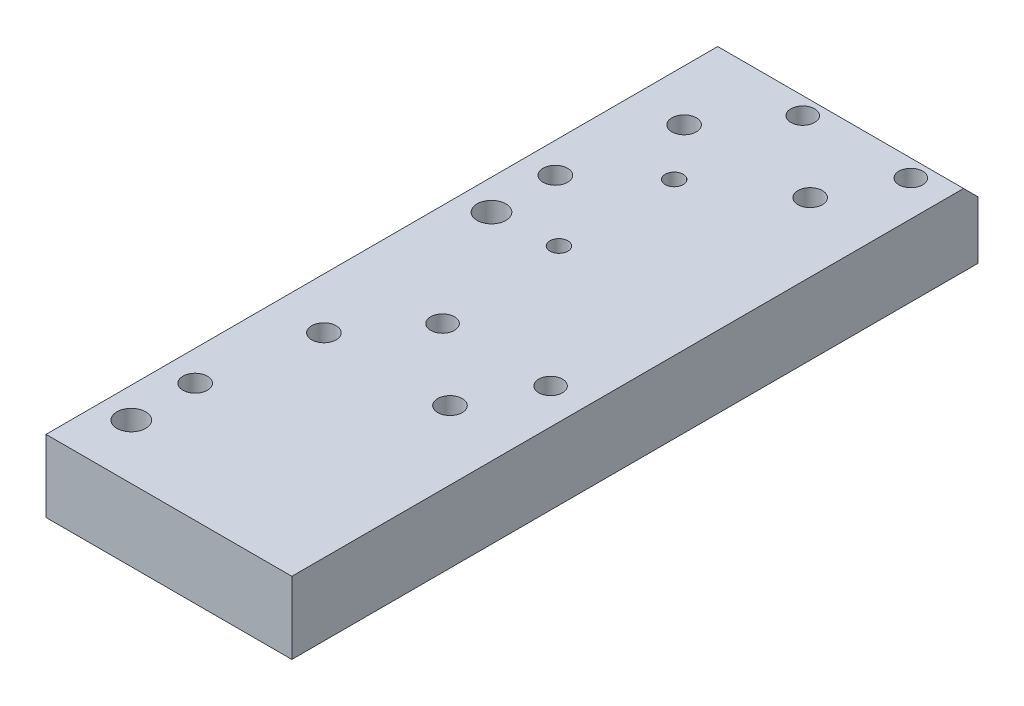
from build123d import *

# Parameters (mm, degrees)
SKETCH1_W                                           = 68.2625
SKETCH1_H                                           = 190.5
BOSS_EXTRUDE1_DEPTH                                 = 20
CHAMFER1_SIZE                                       = 4
M8_TAPPED_HOLE1_D                                   = 6.8
F_8_0_8_DIAMETER_HOLE1_D                            = 8
CUT_EXTRUDE1_DEPTH                                  = 11
FILLET1_R                                           = 0.254
CBORE_FOR_M6_HEX_SOCKET_HEAD_CAP_SCREW1_D           = 6.6
CBORE_FOR_M6_HEX_SOCKET_HEAD_CAP_SCREW1_CBORE_D     = 11
CBORE_FOR_M6_HEX_SOCKET_HEAD_CAP_SCREW1_CBORE_DEPTH = 7
M6_TAPPED_HOLE1_D                                   = 5
M6_TAPPED_HOLE1_DEPTH                               = 27.9908
M6_TAPPED_HOLE1_TIP                                 = 1.502151548


with BuildPart() as part:
    # Sketch1 → Boss-Extrude1 (new body)
    with BuildSketch(Plane(origin=(0, 0, 0), x_dir=(1, 0, 0), z_dir=(0, 1, 0))):
        with Locations((-34.13125, 0)):
            Rectangle(SKETCH1_W, SKETCH1_H)
    extrude(amount=BOSS_EXTRUDE1_DEPTH)

    # Chamfer1
    chamfer1_edges = [part.edges().sort_by_distance(p)[0] for p in [
        (-34.13125, 20, -95.25),
    ]]
    chamfer(chamfer1_edges, length=CHAMFER1_SIZE)

    # M8 Tapped Hole1 (through all)
    with Locations(Plane(origin=(0, 20, 0), x_dir=(1, 0, 0), z_dir=(0, 1, 0))):
        with Locations((-59.85, -62.25), (-54.1, -32.25), (-19.1, -32.25), (-59.85, 37.75), (-54.1, 67.75), (-19.1, 67.75)):
            Hole(M8_TAPPED_HOLE1_D / 2)

    # Ø8.0 (8) Diameter Hole1 (through all)
    with Locations(Plane(origin=(0, 20, 0), x_dir=(1, 0, 0), z_dir=(0, 1, 0))):
        with Locations((-59.85, 20.0208), (-59.85, -79.9792)):
            Hole(F_8_0_8_DIAMETER_HOLE1_D / 2)

    # Sketch6 → Cut-Extrude1 (cut)
    with BuildSketch(Plane.XZ):
        with BuildLine():
            Line((-68.2625, 85.1242), (-54.85, 85.1242))
            ThreePointArc((-54.85, 85.1242), (-49.705, 79.9792), (-54.85, 74.8342))
            Line((-54.85, 74.8342), (-68.2625, 74.8342))
            ThreePointArc((-68.2625, 74.8342), (-73.4075, 79.9792), (-68.2625, 85.1242))
        make_face()
        with BuildLine():
            Line((-68.2625, -14.8758), (-54.85, -14.8758))
            ThreePointArc((-54.85, -14.8758), (-49.705, -20.0208), (-54.85, -25.1658))
            Line((-54.85, -25.1658), (-68.2625, -25.1658))
            ThreePointArc((-68.2625, -25.1658), (-73.4075, -20.0208), (-68.2625, -14.8758))
        make_face()
    extrude(amount=-CUT_EXTRUDE1_DEPTH, mode=Mode.SUBTRACT)

    # Fillet1
    fillet1_edges = [part.edges().sort_by_distance(p)[0] for p in [
        (-61.55625, 11, 85.1242),
        (-49.705, 11, 79.9792),
        (-61.55625, 11, 74.8342),
        (-61.55625, 11, -14.8758),
        (-49.705, 11, -20.0208),
        (-61.55625, 11, -25.1658),
    ]]
    fillet(fillet1_edges, radius=FILLET1_R)

    # CBORE for M6 Hex Socket Head Cap Screw1 (through all)
    with Locations(Plane(origin=(0, 0, 0), x_dir=(-1, 0, 0), z_dir=(0, -1, 0))):
        with Locations((9.849999954, 86.434800002), (39.849999954, 86.434800002), (39.849999954, -13.565199998), (9.849999954, -13.565199998)):
            CounterBoreHole(CBORE_FOR_M6_HEX_SOCKET_HEAD_CAP_SCREW1_D / 2, CBORE_FOR_M6_HEX_SOCKET_HEAD_CAP_SCREW1_CBORE_D / 2, CBORE_FOR_M6_HEX_SOCKET_HEAD_CAP_SCREW1_CBORE_DEPTH)

    # M6 Tapped Hole1
    with Locations(Plane(origin=(0, 0, 0), x_dir=(-1, 0, 0), z_dir=(0, -1, 0))):
        with Locations((42.35, 21.249999996), (42.35, 53.249999996)):
            Hole(M6_TAPPED_HOLE1_D / 2, depth=M6_TAPPED_HOLE1_DEPTH)
            with Locations((0, 0, -(M6_TAPPED_HOLE1_DEPTH + M6_TAPPED_HOLE1_TIP / 2))):  # 118° drill point
                Cone(0, M6_TAPPED_HOLE1_D / 2, M6_TAPPED_HOLE1_TIP, mode=Mode.SUBTRACT)


solid = part.part
